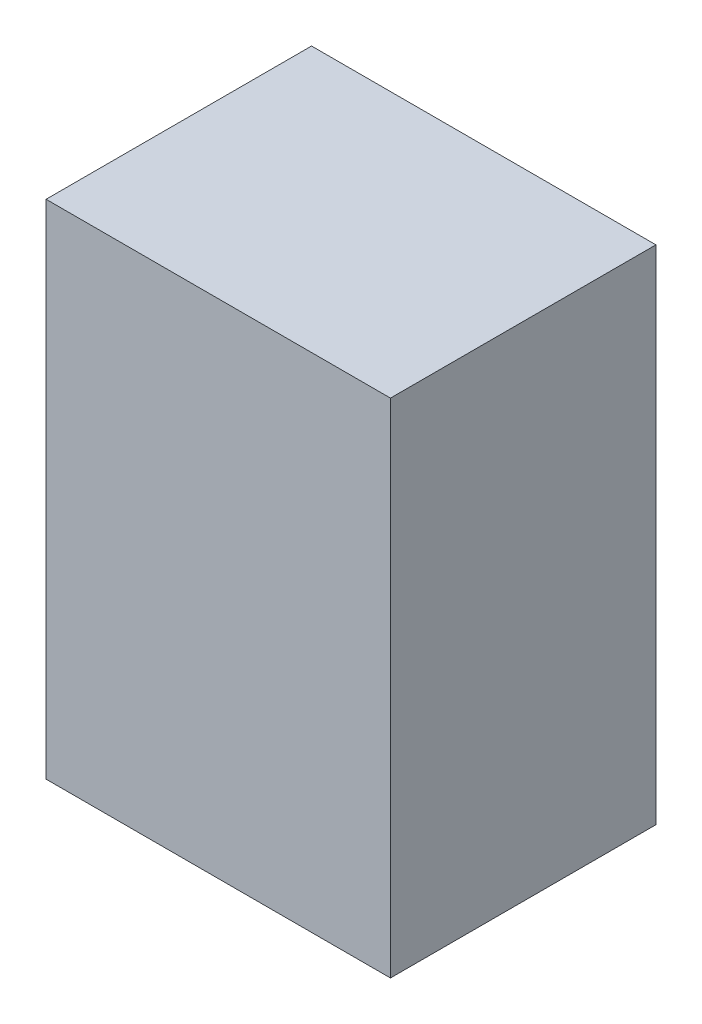
from build123d import *

# Parameters (mm, degrees)
SKETCH_1_W      = 4.8
SKETCH_1_H      = 3.7
EXTRUDE_1_DEPTH = 7


with BuildPart() as part:
    # 草图1 → 凸台-拉伸1 (new body)
    with BuildSketch(Plane(origin=(0, 0, 0), x_dir=(1, 0, 0), z_dir=(0, 1, 0))):
        Rectangle(SKETCH_1_W, SKETCH_1_H)
    extrude(amount=EXTRUDE_1_DEPTH)


solid = part.part
